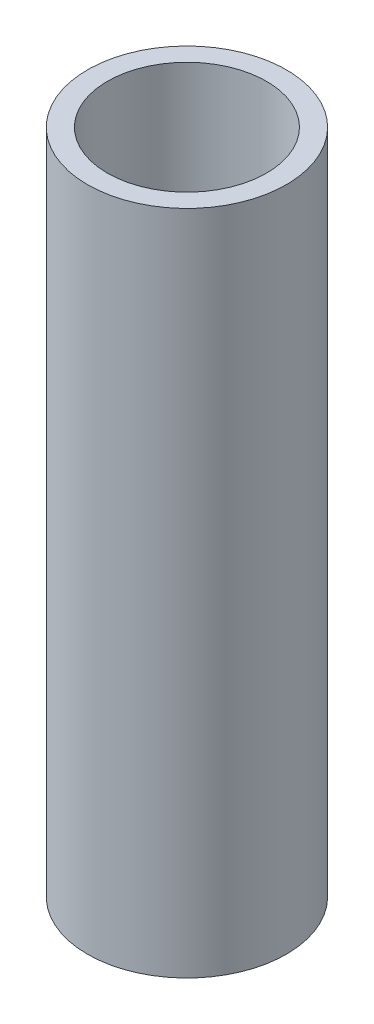
from build123d import *

# Parameters (mm, degrees)
SKETCH1_R           = 50
SKETCH1_R_2         = 40
BOSS_EXTRUDE1_DEPTH = 335
SCALE1_SCALE        = 0.75


with BuildPart() as part:
    # Sketch1 → Boss-Extrude1 (new body)
    with BuildSketch(Plane(origin=(0, 0, 0), x_dir=(1, 0, 0), z_dir=(0, 1, 0))):
        with Locations(Location((0, 0, 0), (0, 0, 270))):
            Circle(SKETCH1_R)
        with Locations(Location((0, 0, 0), (0, 0, 270))):
            Circle(SKETCH1_R_2, mode=Mode.SUBTRACT)
    extrude(amount=BOSS_EXTRUDE1_DEPTH)


with BuildPart() as part_1:
    # Scale1: scaled about (0, 167.5, 0)
    add(part.part.scale(SCALE1_SCALE).moved(Location((0, 41.875, 0))))


solid = part_1.part
